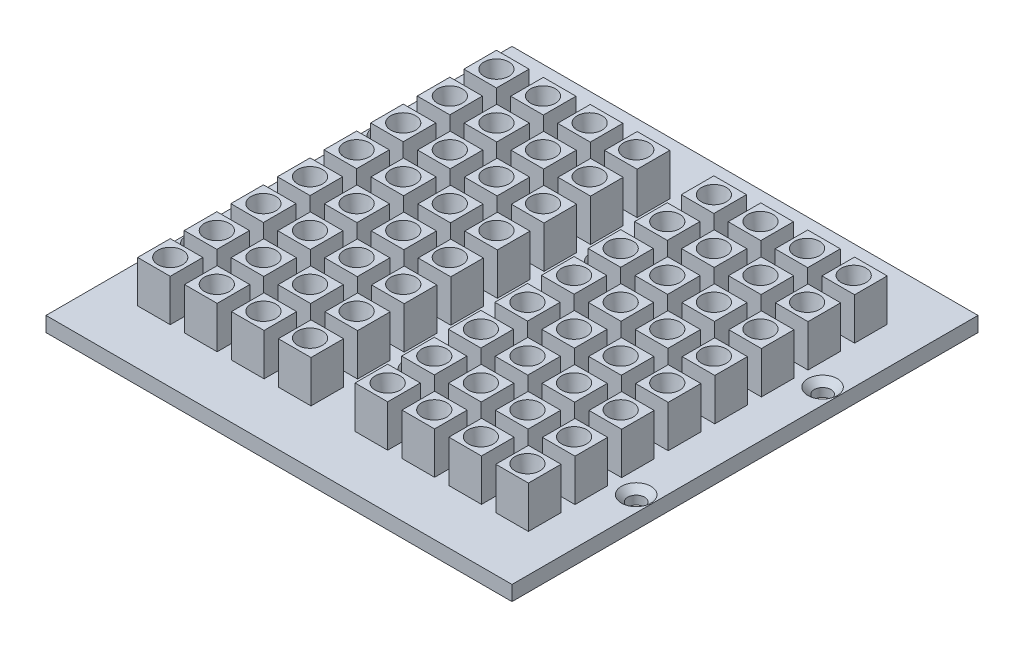
from build123d import *

# Parameters (mm, degrees)
SKETCH1_W                           = 122
SKETCH1_H                           = 100
BOSS_EXTRUDE1_DEPTH                 = 3.2
M3_BLOCK_MOUNTING_HOLES_D           = 3.6
M3_BLOCK_MOUNTING_HOLES_CSINK_D     = 6.3
M3_BLOCK_MOUNTING_HOLES_CSINK_ANGLE = 90
WELLSSQUARE_W                       = 7
WELLSSQUARE_H                       = 7
BOSS_EXTRUDE4_DEPTH                 = 9
WELLHOLES_R                         = 2.676
CUT_EXTRUDE1_DEPTH                  = 11.176
CUT_EXTRUDE1_TAPER                  = 8.75
SKETCH16_W                          = 7
SKETCH16_H                          = 7
BOSS_EXTRUDE5_DEPTH                 = 9
SKETCH18_R                          = 2.675
CUT_EXTRUDE2_DEPTH                  = 11.176
CUT_EXTRUDE2_TAPER                  = 8.75
BLOCK_TRIM_W                        = 11
BLOCK_TRIM_H                        = 100
CUT_EXTRUDE3_DEPTH                  = 11.176


with BuildPart() as part:
    # Sketch1 → Boss-Extrude1 (new body)
    with BuildSketch(Plane(origin=(0, 0, 0), x_dir=(1, 0, 0), z_dir=(0, 1, 0))):
        with Locations((61, 50)):
            Rectangle(SKETCH1_W, SKETCH1_H)
    extrude(amount=BOSS_EXTRUDE1_DEPTH)

    # M3 Block Mounting holes (through all)
    with Locations(Plane(origin=(14.33, 3.2, -70), x_dir=(0, 0, 1), z_dir=(0, 1, 0))):
        with Locations((0, 0), (0, 46.66), (0, 93.32), (40, 93.32), (40, 46.66), (40, 0)):
            CounterSinkHole(M3_BLOCK_MOUNTING_HOLES_D / 2, M3_BLOCK_MOUNTING_HOLES_CSINK_D / 2, counter_sink_angle=M3_BLOCK_MOUNTING_HOLES_CSINK_ANGLE)

    # WellsSquare → Boss-Extrude4 (add)
    with BuildSketch(Plane(origin=(0, 3.2, 0), x_dir=(1, 0, 0), z_dir=(0, 1, 0))):
        with Locations((22.56, 85.1)):
            Rectangle(WELLSSQUARE_W, WELLSSQUARE_H)
        with Locations((32.626666667, 85.1)):
            Rectangle(WELLSSQUARE_W, WELLSSQUARE_H)
        with Locations((42.693333333, 85.1)):
            Rectangle(WELLSSQUARE_W, WELLSSQUARE_H)
        with Locations((52.76, 85.1)):
            Rectangle(WELLSSQUARE_W, WELLSSQUARE_H)
        with Locations((32.626666667, 75.1)):
            Rectangle(WELLSSQUARE_W, WELLSSQUARE_H)
        with Locations((42.693333333, 75.1)):
            Rectangle(WELLSSQUARE_W, WELLSSQUARE_H)
        with Locations((52.76, 75.1)):
            Rectangle(WELLSSQUARE_W, WELLSSQUARE_H)
        with Locations((32.626666667, 65.1)):
            Rectangle(WELLSSQUARE_W, WELLSSQUARE_H)
        with Locations((42.693333333, 65.1)):
            Rectangle(WELLSSQUARE_W, WELLSSQUARE_H)
        with Locations((52.76, 65.1)):
            Rectangle(WELLSSQUARE_W, WELLSSQUARE_H)
        with Locations((32.626666667, 55.1)):
            Rectangle(WELLSSQUARE_W, WELLSSQUARE_H)
        with Locations((42.693333333, 55.1)):
            Rectangle(WELLSSQUARE_W, WELLSSQUARE_H)
        with Locations((52.76, 55.1)):
            Rectangle(WELLSSQUARE_W, WELLSSQUARE_H)
        with Locations((32.626666667, 45.1)):
            Rectangle(WELLSSQUARE_W, WELLSSQUARE_H)
        with Locations((42.693333333, 45.1)):
            Rectangle(WELLSSQUARE_W, WELLSSQUARE_H)
        with Locations((52.76, 45.1)):
            Rectangle(WELLSSQUARE_W, WELLSSQUARE_H)
        with Locations((32.626666667, 35.1)):
            Rectangle(WELLSSQUARE_W, WELLSSQUARE_H)
        with Locations((42.693333333, 35.1)):
            Rectangle(WELLSSQUARE_W, WELLSSQUARE_H)
        with Locations((52.76, 35.1)):
            Rectangle(WELLSSQUARE_W, WELLSSQUARE_H)
        with Locations((32.626666667, 25.1)):
            Rectangle(WELLSSQUARE_W, WELLSSQUARE_H)
        with Locations((42.693333333, 25.1)):
            Rectangle(WELLSSQUARE_W, WELLSSQUARE_H)
        with Locations((52.76, 25.1)):
            Rectangle(WELLSSQUARE_W, WELLSSQUARE_H)
        with Locations((32.626666667, 15.1)):
            Rectangle(WELLSSQUARE_W, WELLSSQUARE_H)
        with Locations((42.693333333, 15.1)):
            Rectangle(WELLSSQUARE_W, WELLSSQUARE_H)
        with Locations((52.76, 15.1)):
            Rectangle(WELLSSQUARE_W, WELLSSQUARE_H)
        with Locations((22.56, 75.1)):
            Rectangle(WELLSSQUARE_W, WELLSSQUARE_H)
        with Locations((22.56, 65.1)):
            Rectangle(WELLSSQUARE_W, WELLSSQUARE_H)
        with Locations((22.56, 55.1)):
            Rectangle(WELLSSQUARE_W, WELLSSQUARE_H)
        with Locations((22.56, 45.1)):
            Rectangle(WELLSSQUARE_W, WELLSSQUARE_H)
        with Locations((22.56, 35.1)):
            Rectangle(WELLSSQUARE_W, WELLSSQUARE_H)
        with Locations((22.56, 25.1)):
            Rectangle(WELLSSQUARE_W, WELLSSQUARE_H)
        with Locations((22.56, 15.1)):
            Rectangle(WELLSSQUARE_W, WELLSSQUARE_H)
    extrude(amount=BOSS_EXTRUDE4_DEPTH)

    # WellHoles → Cut-Extrude1 (cut)
    with BuildSketch(Plane(origin=(0, 12.2, 0), x_dir=(1, 0, 0), z_dir=(0, 1, 0))):
        with Locations((22.56, 85.1)):
            Circle(WELLHOLES_R)
        with Locations((32.56, 85.1)):
            Circle(WELLHOLES_R)
        with Locations((42.56, 85.1)):
            Circle(WELLHOLES_R)
        with Locations((52.56, 85.1)):
            Circle(WELLHOLES_R)
        with Locations((32.56, 75.1)):
            Circle(WELLHOLES_R)
        with Locations((42.56, 75.1)):
            Circle(WELLHOLES_R)
        with Locations((52.56, 75.1)):
            Circle(WELLHOLES_R)
        with Locations((32.56, 65.1)):
            Circle(WELLHOLES_R)
        with Locations((42.56, 65.1)):
            Circle(WELLHOLES_R)
        with Locations((52.56, 65.1)):
            Circle(WELLHOLES_R)
        with Locations((32.56, 55.1)):
            Circle(WELLHOLES_R)
        with Locations((42.56, 55.1)):
            Circle(WELLHOLES_R)
        with Locations((52.56, 55.1)):
            Circle(WELLHOLES_R)
        with Locations((32.56, 45.1)):
            Circle(WELLHOLES_R)
        with Locations((42.56, 45.1)):
            Circle(WELLHOLES_R)
        with Locations((52.56, 45.1)):
            Circle(WELLHOLES_R)
        with Locations((32.56, 35.1)):
            Circle(WELLHOLES_R)
        with Locations((42.56, 35.1)):
            Circle(WELLHOLES_R)
        with Locations((52.56, 35.1)):
            Circle(WELLHOLES_R)
        with Locations((32.56, 25.1)):
            Circle(WELLHOLES_R)
        with Locations((42.56, 25.1)):
            Circle(WELLHOLES_R)
        with Locations((52.56, 25.1)):
            Circle(WELLHOLES_R)
        with Locations((32.56, 15.1)):
            Circle(WELLHOLES_R)
        with Locations((42.56, 15.1)):
            Circle(WELLHOLES_R)
        with Locations((52.56, 15.1)):
            Circle(WELLHOLES_R)
        with Locations((22.56, 75.1)):
            Circle(WELLHOLES_R)
        with Locations((22.56, 65.1)):
            Circle(WELLHOLES_R)
        with Locations((22.56, 55.1)):
            Circle(WELLHOLES_R)
        with Locations((22.56, 45.1)):
            Circle(WELLHOLES_R)
        with Locations((22.56, 35.1)):
            Circle(WELLHOLES_R)
        with Locations((22.56, 25.1)):
            Circle(WELLHOLES_R)
        with Locations((22.56, 15.1)):
            Circle(WELLHOLES_R)
    extrude(amount=-CUT_EXTRUDE1_DEPTH, taper=CUT_EXTRUDE1_TAPER, mode=Mode.SUBTRACT)

    # Sketch16 → Boss-Extrude5 (add)
    with BuildSketch(Plane(origin=(0, 3.2, 0), x_dir=(1, 0, 0), z_dir=(0, 1, 0))):
        with Locations((69.22, 85.1)):
            Rectangle(SKETCH16_W, SKETCH16_H)
        with Locations((79.286666667, 85.1)):
            Rectangle(SKETCH16_W, SKETCH16_H)
        with Locations((89.353333333, 85.1)):
            Rectangle(SKETCH16_W, SKETCH16_H)
        with Locations((99.42, 85.1)):
            Rectangle(SKETCH16_W, SKETCH16_H)
        with Locations((79.286666667, 75.1)):
            Rectangle(SKETCH16_W, SKETCH16_H)
        with Locations((89.353333333, 75.1)):
            Rectangle(SKETCH16_W, SKETCH16_H)
        with Locations((99.42, 75.1)):
            Rectangle(SKETCH16_W, SKETCH16_H)
        with Locations((79.286666667, 65.1)):
            Rectangle(SKETCH16_W, SKETCH16_H)
        with Locations((89.353333333, 65.1)):
            Rectangle(SKETCH16_W, SKETCH16_H)
        with Locations((99.42, 65.1)):
            Rectangle(SKETCH16_W, SKETCH16_H)
        with Locations((79.286666667, 55.1)):
            Rectangle(SKETCH16_W, SKETCH16_H)
        with Locations((89.353333333, 55.1)):
            Rectangle(SKETCH16_W, SKETCH16_H)
        with Locations((99.42, 55.1)):
            Rectangle(SKETCH16_W, SKETCH16_H)
        with Locations((79.286666667, 45.1)):
            Rectangle(SKETCH16_W, SKETCH16_H)
        with Locations((89.353333333, 45.1)):
            Rectangle(SKETCH16_W, SKETCH16_H)
        with Locations((99.42, 45.1)):
            Rectangle(SKETCH16_W, SKETCH16_H)
        with Locations((79.286666667, 35.1)):
            Rectangle(SKETCH16_W, SKETCH16_H)
        with Locations((89.353333333, 35.1)):
            Rectangle(SKETCH16_W, SKETCH16_H)
        with Locations((99.42, 35.1)):
            Rectangle(SKETCH16_W, SKETCH16_H)
        with Locations((79.286666667, 25.1)):
            Rectangle(SKETCH16_W, SKETCH16_H)
        with Locations((89.353333333, 25.1)):
            Rectangle(SKETCH16_W, SKETCH16_H)
        with Locations((99.42, 25.1)):
            Rectangle(SKETCH16_W, SKETCH16_H)
        with Locations((79.286666667, 15.1)):
            Rectangle(SKETCH16_W, SKETCH16_H)
        with Locations((89.353333333, 15.1)):
            Rectangle(SKETCH16_W, SKETCH16_H)
        with Locations((99.42, 15.1)):
            Rectangle(SKETCH16_W, SKETCH16_H)
        with Locations((69.22, 75.1)):
            Rectangle(SKETCH16_W, SKETCH16_H)
        with Locations((69.22, 65.1)):
            Rectangle(SKETCH16_W, SKETCH16_H)
        with Locations((69.22, 55.1)):
            Rectangle(SKETCH16_W, SKETCH16_H)
        with Locations((69.22, 45.1)):
            Rectangle(SKETCH16_W, SKETCH16_H)
        with Locations((69.22, 35.1)):
            Rectangle(SKETCH16_W, SKETCH16_H)
        with Locations((69.22, 25.1)):
            Rectangle(SKETCH16_W, SKETCH16_H)
        with Locations((69.22, 15.1)):
            Rectangle(SKETCH16_W, SKETCH16_H)
    extrude(amount=BOSS_EXTRUDE5_DEPTH)

    # Sketch18 → Cut-Extrude2 (cut)
    with BuildSketch(Plane(origin=(0, 12.2, 0), x_dir=(1, 0, 0), z_dir=(0, 1, 0))):
        with Locations((69.22, 85.1)):
            Circle(SKETCH18_R)
        with Locations((79.22, 85.1)):
            Circle(SKETCH18_R)
        with Locations((89.22, 85.1)):
            Circle(SKETCH18_R)
        with Locations((99.22, 85.1)):
            Circle(SKETCH18_R)
        with Locations((79.22, 75.1)):
            Circle(SKETCH18_R)
        with Locations((89.22, 75.1)):
            Circle(SKETCH18_R)
        with Locations((99.22, 75.1)):
            Circle(SKETCH18_R)
        with Locations((79.22, 65.1)):
            Circle(SKETCH18_R)
        with Locations((89.22, 65.1)):
            Circle(SKETCH18_R)
        with Locations((99.22, 65.1)):
            Circle(SKETCH18_R)
        with Locations((79.22, 55.1)):
            Circle(SKETCH18_R)
        with Locations((89.22, 55.1)):
            Circle(SKETCH18_R)
        with Locations((99.22, 55.1)):
            Circle(SKETCH18_R)
        with Locations((79.22, 45.1)):
            Circle(SKETCH18_R)
        with Locations((89.22, 45.1)):
            Circle(SKETCH18_R)
        with Locations((99.22, 45.1)):
            Circle(SKETCH18_R)
        with Locations((79.22, 35.1)):
            Circle(SKETCH18_R)
        with Locations((89.22, 35.1)):
            Circle(SKETCH18_R)
        with Locations((99.22, 35.1)):
            Circle(SKETCH18_R)
        with Locations((79.22, 25.1)):
            Circle(SKETCH18_R)
        with Locations((89.22, 25.1)):
            Circle(SKETCH18_R)
        with Locations((99.22, 25.1)):
            Circle(SKETCH18_R)
        with Locations((79.22, 15.1)):
            Circle(SKETCH18_R)
        with Locations((89.22, 15.1)):
            Circle(SKETCH18_R)
        with Locations((99.22, 15.1)):
            Circle(SKETCH18_R)
        with Locations((69.22, 75.1)):
            Circle(SKETCH18_R)
        with Locations((69.22, 65.1)):
            Circle(SKETCH18_R)
        with Locations((69.22, 55.1)):
            Circle(SKETCH18_R)
        with Locations((69.22, 45.1)):
            Circle(SKETCH18_R)
        with Locations((69.22, 35.1)):
            Circle(SKETCH18_R)
        with Locations((69.22, 25.1)):
            Circle(SKETCH18_R)
        with Locations((69.22, 15.1)):
            Circle(SKETCH18_R)
    extrude(amount=-CUT_EXTRUDE2_DEPTH, taper=CUT_EXTRUDE2_TAPER, mode=Mode.SUBTRACT)

    # Block Trim → Cut-Extrude3 (cut)
    with BuildSketch(Plane(origin=(0, 3.2, 0), x_dir=(1, 0, 0), z_dir=(0, 1, 0))):
        with Locations((5.5, 50)):
            Rectangle(BLOCK_TRIM_W, BLOCK_TRIM_H)
        with Locations((116.5, 50)):
            Rectangle(BLOCK_TRIM_W, BLOCK_TRIM_H)
    extrude(amount=-CUT_EXTRUDE3_DEPTH, mode=Mode.SUBTRACT)


solid = part.part
